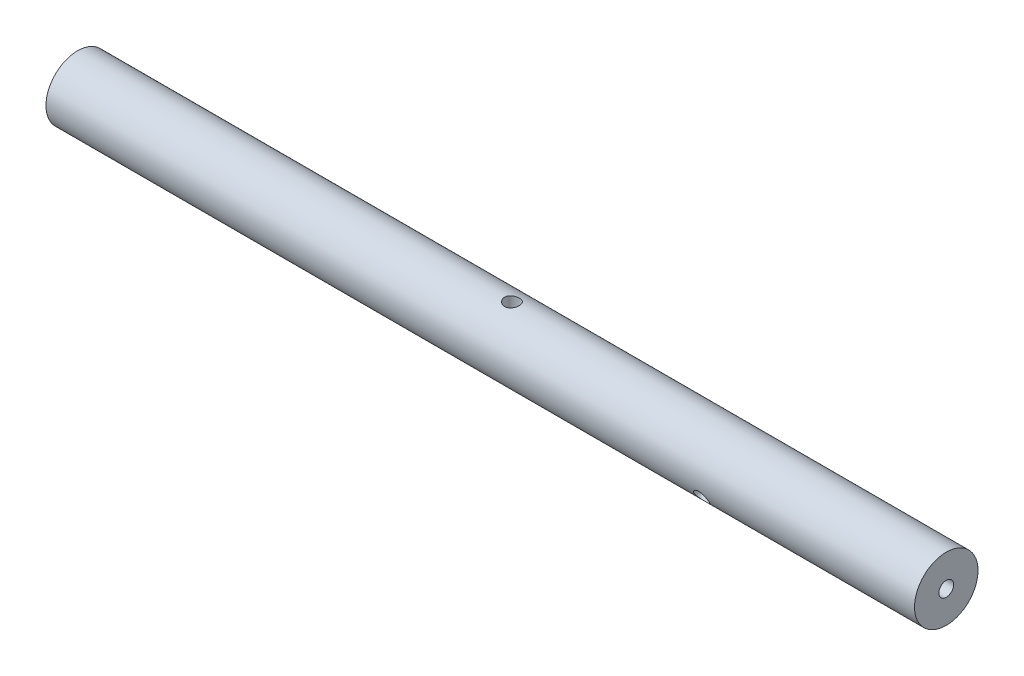
from build123d import *

# Parameters (mm, degrees)
SKETCH1_R                            = 11.11
BOSS_EXTRUDE1_DEPTH                  = 304
F_3_0_3_DIAMETER_HOLE2_D             = 3
F_3_0_3_DIAMETER_HOLE2_DEPTH         = 11
F_3_0_3_DIAMETER_HOLE2_TIP           = 0.901290929
F_13_64_0_20313_DIAMETER_HOLE2_D     = 5.159502
F_13_64_0_20313_DIAMETER_HOLE2_DEPTH = 7
F_13_64_0_20313_DIAMETER_HOLE2_TIP   = 1.550070783
F_13_64_0_20313_DIAMETER_HOLE4_D     = 5.159502
F_13_64_0_20313_DIAMETER_HOLE4_DEPTH = 7
F_13_64_0_20313_DIAMETER_HOLE4_TIP   = 1.550070783
F_13_64_0_20313_DIAMETER_HOLE5_D     = 5.159502
F_13_64_0_20313_DIAMETER_HOLE5_DEPTH = 7
F_13_64_0_20313_DIAMETER_HOLE5_TIP   = 1.550070783
F_13_64_0_20313_DIAMETER_HOLE6_D     = 5.159502
F_13_64_0_20313_DIAMETER_HOLE6_DEPTH = 7
F_13_64_0_20313_DIAMETER_HOLE6_TIP   = 1.550070783


with BuildPart() as part:
    # Sketch1 → Boss-Extrude1 (new body)
    with BuildSketch(Plane(origin=(0, 0, 0), x_dir=(0, 0, -1), z_dir=(1, 0, 0))):
        Circle(SKETCH1_R)
    extrude(amount=BOSS_EXTRUDE1_DEPTH)

    # Ø3.0 (3) Diameter Hole2
    with Locations(Plane.ZY):
        with Locations((0, 5.3)):
            Hole(F_3_0_3_DIAMETER_HOLE2_D / 2, depth=F_3_0_3_DIAMETER_HOLE2_DEPTH)
            with Locations((0, 0, -(F_3_0_3_DIAMETER_HOLE2_DEPTH + F_3_0_3_DIAMETER_HOLE2_TIP / 2))):  # 118° drill point
                Cone(0, F_3_0_3_DIAMETER_HOLE2_D / 2, F_3_0_3_DIAMETER_HOLE2_TIP, mode=Mode.SUBTRACT)

    # 13/64 (0.20313) Diameter Hole2
    with Locations(Plane(origin=(0, 11.11, 0), x_dir=(1, 0, 0), z_dir=(0, 1, 0))):
        with Locations((152, 0)):
            Hole(F_13_64_0_20313_DIAMETER_HOLE2_D / 2, depth=F_13_64_0_20313_DIAMETER_HOLE2_DEPTH)
            with Locations((0, 0, -(F_13_64_0_20313_DIAMETER_HOLE2_DEPTH + F_13_64_0_20313_DIAMETER_HOLE2_TIP / 2))):  # 118° drill point
                Cone(0, F_13_64_0_20313_DIAMETER_HOLE2_D / 2, F_13_64_0_20313_DIAMETER_HOLE2_TIP, mode=Mode.SUBTRACT)

    # 13/64 (0.20313) Diameter Hole4
    with Locations(Plane(origin=(0, -5.555, -9.621542236), x_dir=(-1, 0, 0), z_dir=(0, -0.50000000000001, -0.8660254037844328))):
        with Locations((-76, 0)):
            Hole(F_13_64_0_20313_DIAMETER_HOLE4_D / 2, depth=F_13_64_0_20313_DIAMETER_HOLE4_DEPTH)
            with Locations((0, 0, -(F_13_64_0_20313_DIAMETER_HOLE4_DEPTH + F_13_64_0_20313_DIAMETER_HOLE4_TIP / 2))):  # 118° drill point
                Cone(0, F_13_64_0_20313_DIAMETER_HOLE4_D / 2, F_13_64_0_20313_DIAMETER_HOLE4_TIP, mode=Mode.SUBTRACT)

    # 13/64 (0.20313) Diameter Hole5
    with Locations(Plane(origin=(0, -5.555, 9.621542236), x_dir=(-1, 0, 0), z_dir=(0, -0.499999999999998, 0.8660254037844398))):
        with Locations((-228, 0)):
            Hole(F_13_64_0_20313_DIAMETER_HOLE5_D / 2, depth=F_13_64_0_20313_DIAMETER_HOLE5_DEPTH)
            with Locations((0, 0, -(F_13_64_0_20313_DIAMETER_HOLE5_DEPTH + F_13_64_0_20313_DIAMETER_HOLE5_TIP / 2))):  # 118° drill point
                Cone(0, F_13_64_0_20313_DIAMETER_HOLE5_D / 2, F_13_64_0_20313_DIAMETER_HOLE5_TIP, mode=Mode.SUBTRACT)

    # 13/64 (0.20313) Diameter Hole6
    with Locations(Plane(origin=(304, 0, 0), x_dir=(0, 0, -1), z_dir=(1, 0, 0))):
        with Locations((0, 0)):
            Hole(F_13_64_0_20313_DIAMETER_HOLE6_D / 2, depth=F_13_64_0_20313_DIAMETER_HOLE6_DEPTH)
            with Locations((0, 0, -(F_13_64_0_20313_DIAMETER_HOLE6_DEPTH + F_13_64_0_20313_DIAMETER_HOLE6_TIP / 2))):  # 118° drill point
                Cone(0, F_13_64_0_20313_DIAMETER_HOLE6_D / 2, F_13_64_0_20313_DIAMETER_HOLE6_TIP, mode=Mode.SUBTRACT)


solid = part.part
